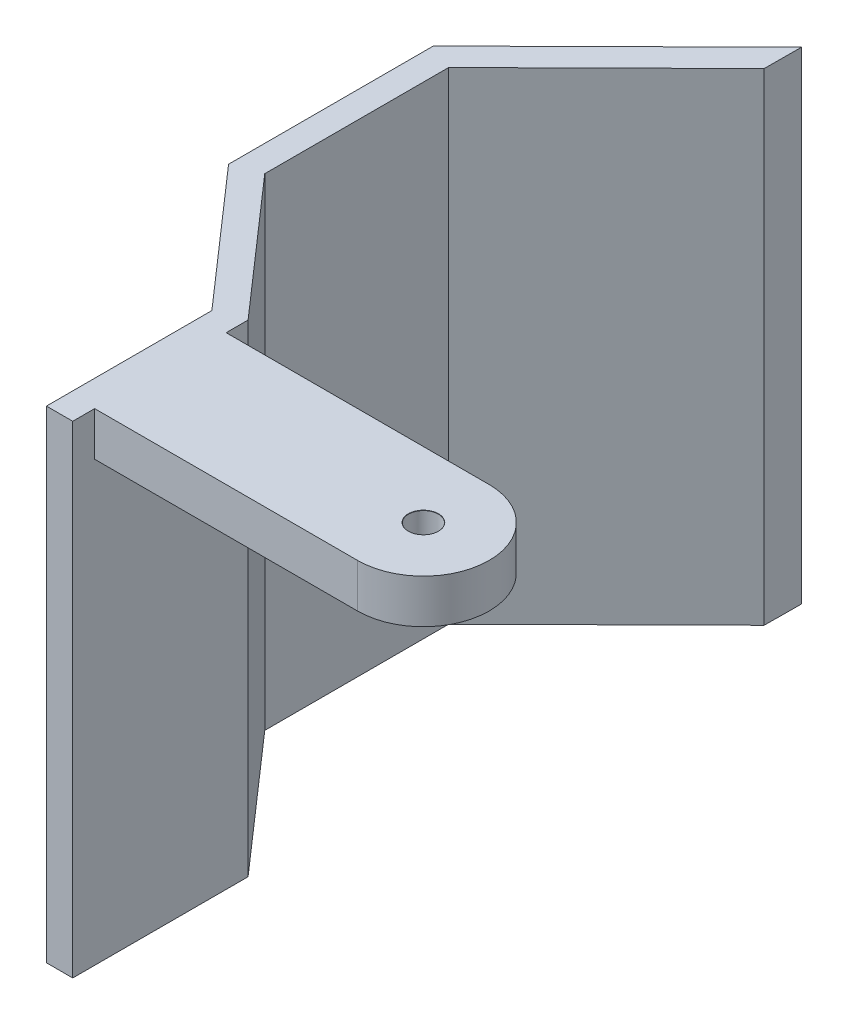
from build123d import *

# Parameters (mm, degrees)
BOSS_EXTRUDE1_DEPTH            = 55
BOSS_EXTRUDE2_START            = 55
BOSS_EXTRUDE2_DEPTH            = 5
M3_CLEARANCE_HOLE1_D           = 3.4
M3_CLEARANCE_HOLE1_CSINK_D     = 3.45
M3_CLEARANCE_HOLE1_CSINK_ANGLE = 90


with BuildPart() as part:
    # Sketch1 → Boss-Extrude1 (new body)
    with BuildSketch(Plane(origin=(0, 0, 0), x_dir=(1, 0, 0), z_dir=(0, 1, 0))):
        Polygon((3, 0), (0, 0), (0, 18.87138772), (-13.505514799, 34.280690781), (-13.505514799, 57.637057616), (7.616499063, 78.521745479), (7.592529724, 74.279172502), (-10.505514799, 56.384476794), (-10.505514799, 35.409303061), (3, 20), align=None)
    extrude(amount=BOSS_EXTRUDE1_DEPTH)

    # Sketch1<3> → Boss-Extrude2 (add)
    with BuildSketch(Plane(origin=(0, 0, 0), x_dir=(1, 0, 0), z_dir=(0, 1, 0)).offset(BOSS_EXTRUDE2_START)):
        with BuildLine():
            Line((3, 17.5), (3, 2.5))
            Line((3, 2.5), (33, 2.5))
            ThreePointArc((33, 2.5), (40.5, 10), (33, 17.5))
            Line((33, 17.5), (3, 17.5))
        make_face()
    extrude(amount=-BOSS_EXTRUDE2_DEPTH)

    # M3 Clearance Hole1 (through all)
    with Locations(Plane(origin=(0, 55, 0), x_dir=(1, 0, 0), z_dir=(0, 1, 0))):
        with Locations((33, 10)):
            CounterSinkHole(M3_CLEARANCE_HOLE1_D / 2, M3_CLEARANCE_HOLE1_CSINK_D / 2, counter_sink_angle=M3_CLEARANCE_HOLE1_CSINK_ANGLE)


solid = part.part
